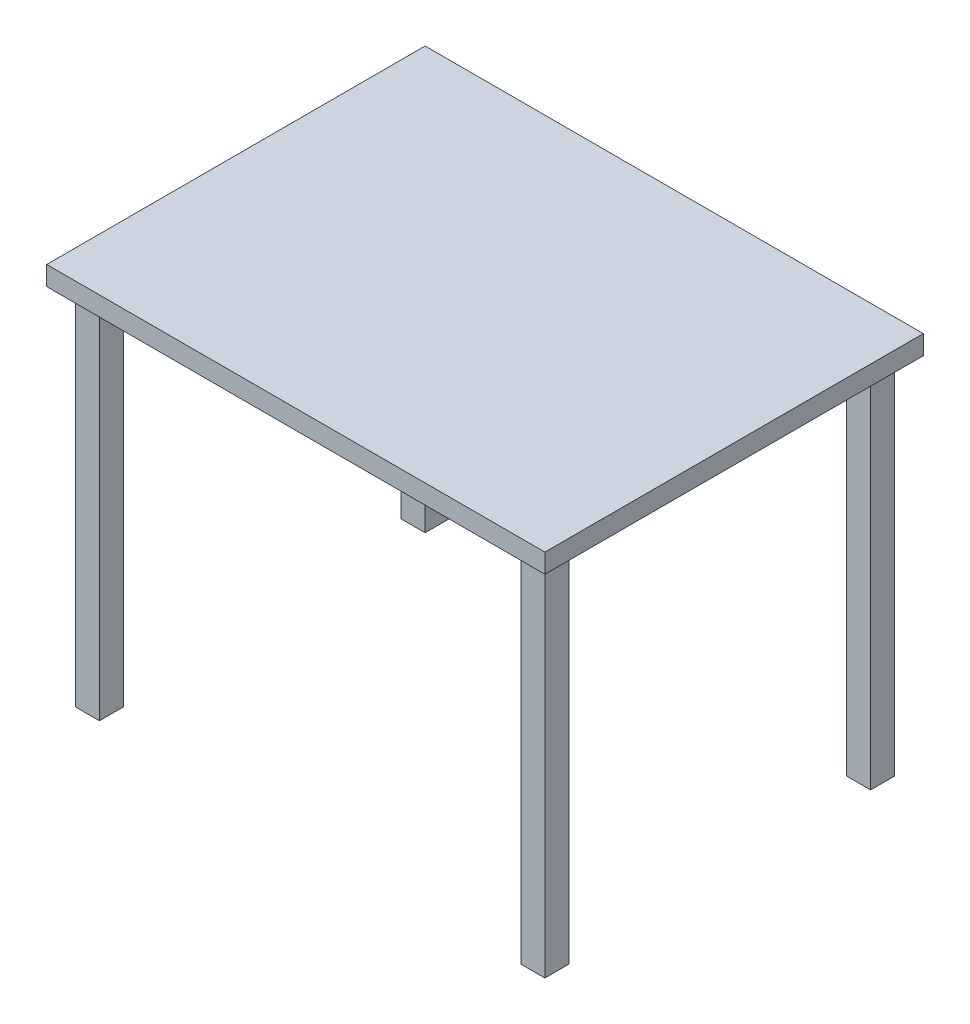
from build123d import *

# Parameters (mm, degrees)
SKETCH1_W           = 1040
SKETCH1_H           = 790
BOSS_EXTRUDE1_DEPTH = 20
SKETCH2_W           = 50
SKETCH2_H           = 50
BOSS_EXTRUDE2_DEPTH = 760


with BuildPart() as part:
    # Sketch1 → Boss-Extrude1 (new, symmetric)
    with BuildSketch(Plane(origin=(0, 0, 0), x_dir=(1, 0, 0), z_dir=(0, 1, 0))):
        Rectangle(SKETCH1_W, SKETCH1_H)
    extrude(amount=BOSS_EXTRUDE1_DEPTH, both=True)

    # Sketch2 → Boss-Extrude2 (add)
    with BuildSketch(Plane.XZ.offset(20)):
        with Locations((-465, 340)):
            Rectangle(SKETCH2_W, SKETCH2_H)
        with Locations((-465, -340)):
            Rectangle(SKETCH2_W, SKETCH2_H)
        with Locations((465, -340)):
            Rectangle(SKETCH2_W, SKETCH2_H)
        with Locations((465, 340)):
            Rectangle(SKETCH2_W, SKETCH2_H)
    extrude(amount=BOSS_EXTRUDE2_DEPTH)


solid = part.part
